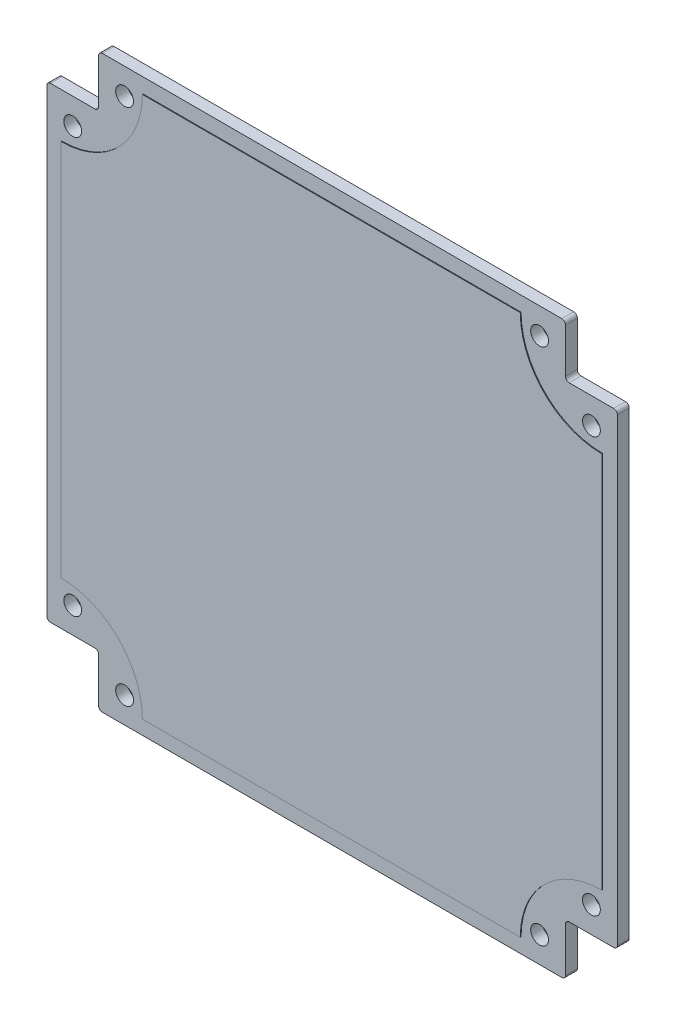
from build123d import *

# Parameters (mm, degrees)
BOSS_EXTRUDE1_DEPTH            = 1.6
BOSS_EXTRUDE2_DEPTH            = 0.1
M2_HOLE1_FIXINGSTRUCTURE_D     = 2.4
M2_HOLE1_FIXINGSTRUCTURE_DEPTH = 200
M2_HOLE1_FIXINGSTRUCTURE_TIP   = 0.721032743


with BuildPart() as part:
    # Sketch1 → Boss-Extrude1 (new body)
    with BuildSketch(Plane.XY):
        with BuildLine():
            Line((-31.5, 38), (-31.5, 32))
            ThreePointArc((-31.5, 32), (-31.646446609, 31.646446609), (-32, 31.5))
            Line((-32, 31.5), (-38, 31.5))
            ThreePointArc((-38, 31.5), (-38.353553391, 31.353553391), (-38.5, 31))
            Line((-38.5, 31), (-38.5, -31))
            ThreePointArc((-38.5, -31), (-38.353553391, -31.353553391), (-38, -31.5))
            Line((-38, -31.5), (-32, -31.5))
            ThreePointArc((-32, -31.5), (-31.646446609, -31.646446609), (-31.5, -32))
            Line((-31.5, -32), (-31.5, -38))
            ThreePointArc((-31.5, -38), (-31.353553391, -38.353553391), (-31, -38.5))
            Line((-31, -38.5), (31, -38.5))
            ThreePointArc((31, -38.5), (31.353553391, -38.353553391), (31.5, -38))
            Line((31.5, -38), (31.5, -32))
            ThreePointArc((31.5, -32), (31.646446609, -31.646446609), (32, -31.5))
            Line((32, -31.5), (38, -31.5))
            ThreePointArc((38, -31.5), (38.353553391, -31.353553391), (38.5, -31))
            Line((38.5, -31), (38.5, 31))
            ThreePointArc((38.5, 31), (38.353553391, 31.353553391), (38, 31.5))
            Line((38, 31.5), (32, 31.5))
            ThreePointArc((32, 31.5), (31.646446609, 31.646446609), (31.5, 32))
            Line((31.5, 32), (31.5, 38))
            ThreePointArc((31.5, 38), (31.353553391, 38.353553391), (31, 38.5))
            Line((31, 38.5), (-31, 38.5))
            ThreePointArc((-31, 38.5), (-31.353553391, 38.353553391), (-31.5, 38))
        make_face()
    extrude(amount=BOSS_EXTRUDE1_DEPTH)

    # Esboço1 → Boss-Extrude2 (add)
    with BuildSketch(Plane.XY.offset(1.6)):
        with BuildLine():
            Line((-25.5, -36.5), (25.5, -36.5))
            ThreePointArc((25.5, -36.5), (28.721825407, -28.721825407), (36.5, -25.5))
            Line((36.5, -25.5), (36.5, 25.5))
            ThreePointArc((36.5, 25.5), (28.721825407, 28.721825407), (25.5, 36.5))
            Line((25.5, 36.5), (-25.5, 36.5))
            ThreePointArc((-25.5, 36.5), (-28.721825407, 28.721825407), (-36.5, 25.5))
            Line((-36.5, 25.5), (-36.5, -25.5))
            ThreePointArc((-36.5, -25.5), (-28.721825407, -28.721825407), (-25.5, -36.5))
        make_face()
    extrude(amount=BOSS_EXTRUDE2_DEPTH)

    # M2 Hole1-FixingStructure
    with Locations(Plane(origin=(0, 0, 0), x_dir=(-1, 0, 0), z_dir=(0, 0, -1))):
        with Locations((-28, 35), (28, 35), (-28, -35), (28, -35), (35, 28), (35, -28), (-35, -28), (-35, 28)):
            Hole(M2_HOLE1_FIXINGSTRUCTURE_D / 2, depth=M2_HOLE1_FIXINGSTRUCTURE_DEPTH)
            with Locations((0, 0, -(M2_HOLE1_FIXINGSTRUCTURE_DEPTH + M2_HOLE1_FIXINGSTRUCTURE_TIP / 2))):  # 118° drill point
                Cone(0, M2_HOLE1_FIXINGSTRUCTURE_D / 2, M2_HOLE1_FIXINGSTRUCTURE_TIP, mode=Mode.SUBTRACT)


solid = part.part
